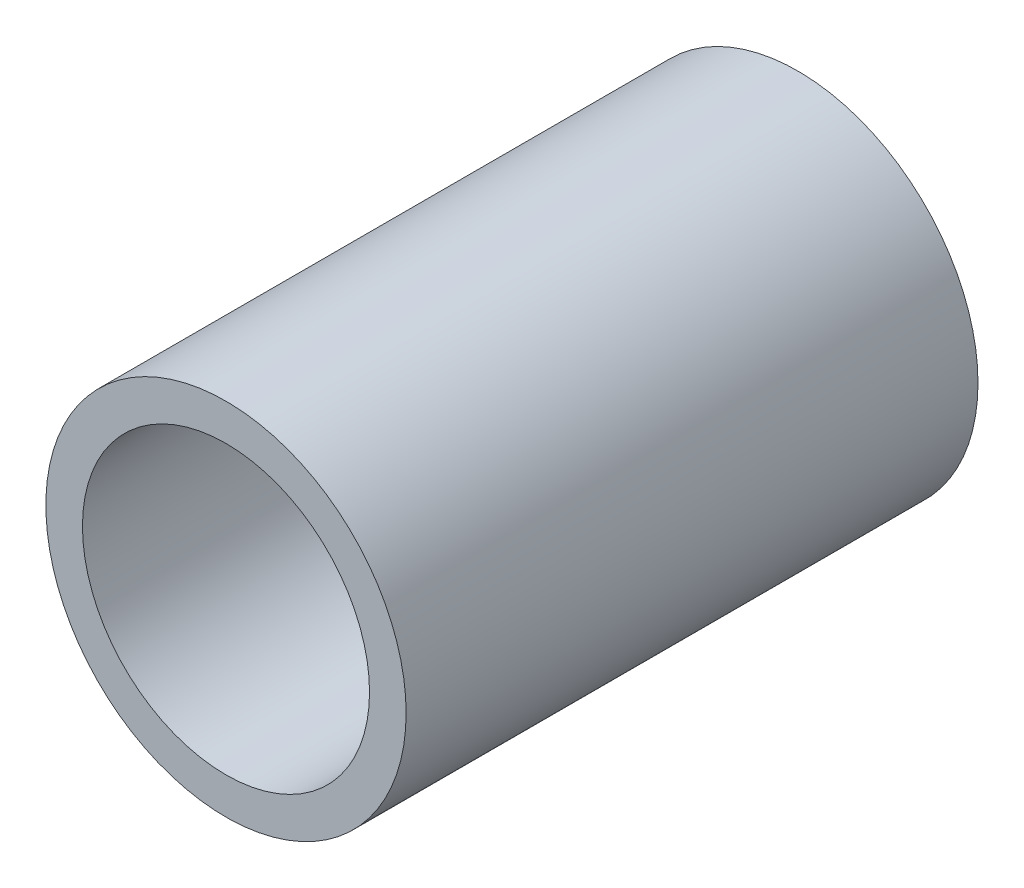
from build123d import *

# Parameters (mm, degrees)
SKETCH1_R      = 4.0005
SKETCH1_R_2    = 3.1877
EXTRUDE1_DEPTH = 6.35


with BuildPart() as part:
    # Sketch1 → Extrude1 (new, symmetric)
    with BuildSketch(Plane.XY):
        Circle(SKETCH1_R)
        Circle(SKETCH1_R_2, mode=Mode.SUBTRACT)
    extrude(amount=EXTRUDE1_DEPTH, both=True)


solid = part.part
